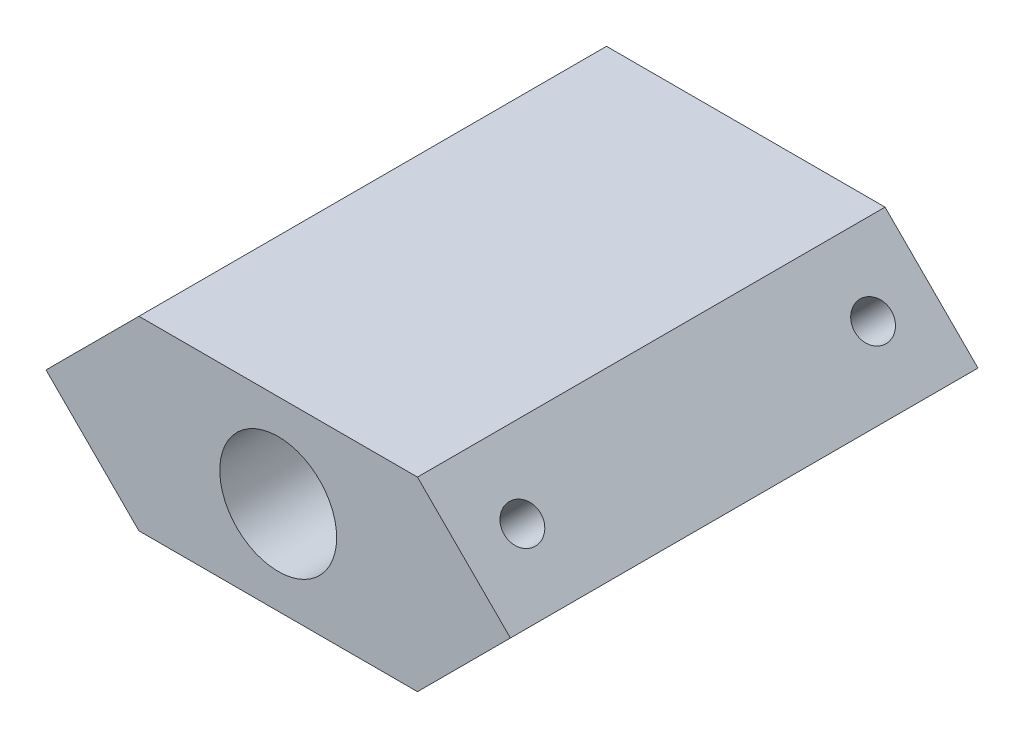
from build123d import *

# Parameters (mm, degrees)
ESQUISSE1_W             = 100.91
ESQUISSE1_H             = 40.386
BOSS_EXTRU_1_DEPTH      = 101.6
ENL_V_MAT_EXTRU_1_DEPTH = 101.6
ENL_V_MAT_EXTRU_2_DEPTH = 149.783121005
ESQUISSE5_R             = 3.975
ENL_V_MAT_EXTRU_3_DEPTH = 20
ESQUISSE6_R             = 3.937
ENL_V_MAT_EXTRU_4_DEPTH = 20
ESQUISSE7_R             = 3.937
ENL_V_MAT_EXTRU_5_DEPTH = 20
ESQUISSE8_R             = 3.937
ENL_V_MAT_EXTRU_6_DEPTH = 20
ESQUISSE9_R             = 6.35
ENL_V_MAT_EXTRU_7_DEPTH = 149.783121005
ESQUISSE10_R            = 9.525
ENL_V_MAT_EXTRU_8_DEPTH = 7.35
ESQUISSE11_R            = 12.7
ENL_V_MAT_EXTRU_9_DEPTH = 20.65


with BuildPart() as part:
    # Esquisse1 → Boss.-Extru.1 (new body)
    with BuildSketch(Plane.XY):
        with Locations((50.455, 20.193)):
            Rectangle(ESQUISSE1_W, ESQUISSE1_H)
    extrude(amount=BOSS_EXTRU_1_DEPTH)

    # Esquisse3 → Enlèv. mat.-Extru.1 (cut)
    with BuildSketch(Plane(origin=(0, 0, 0), x_dir=(-1, 0, 0), z_dir=(0, 0, -1))):
        Polygon((-100.91, 20.193), (-80.717, 0), (-100.91, 0), align=None)
        Polygon((0, 0), (0, 20.193), (-20.193, 0), align=None)
    extrude(amount=-ENL_V_MAT_EXTRU_1_DEPTH, mode=Mode.SUBTRACT)

    # Esquisse4 → Enlèv. mat.-Extru.2 (cut, through all)
    with BuildSketch(Plane(origin=(0, 0, 0), x_dir=(-1, 0, 0), z_dir=(0, 0, -1))):
        Polygon((-100.91, 20.193), (-80.717, 40.386), (-100.91, 40.386), align=None)
        Polygon((0, 40.386), (0, 20.193), (-20.193, 40.386), align=None)
    extrude(amount=-ENL_V_MAT_EXTRU_2_DEPTH, mode=Mode.SUBTRACT)

    # Esquisse5 → Enlèv. mat.-Extru.3 (cut)
    with BuildSketch(Plane(origin=(60.5515, 60.5515, 0), x_dir=(0, 0, -1), z_dir=(0.7071067811865488, 0.7071067811865464, 0))):
        with Locations(Location((-88.9, -42.796930825, 0), (0, 0, 90))):
            Circle(ESQUISSE5_R)
        with Locations(Location((-12.7, -42.796930825, 0), (0, 0, 90))):
            Circle(ESQUISSE5_R)
    extrude(amount=-ENL_V_MAT_EXTRU_3_DEPTH, mode=Mode.SUBTRACT)

    # Esquisse6 → Enlèv. mat.-Extru.4 (cut)
    with BuildSketch(Plane(origin=(10.0965, 10.0965, 0), x_dir=(0, 0, 1), z_dir=(-0.7071067811865475, -0.7071067811865476, 0))):
        with Locations(Location((12.7, 0, 0), (0, 0, 270))):
            Circle(ESQUISSE6_R)
        with Locations(Location((88.9, 0, 0), (0, 0, 270))):
            Circle(ESQUISSE6_R)
    extrude(amount=-ENL_V_MAT_EXTRU_4_DEPTH, mode=Mode.SUBTRACT)

    # Esquisse7 → Enlèv. mat.-Extru.5 (cut)
    with BuildSketch(Plane(origin=(-10.0965, 10.0965, 0), x_dir=(0, 0, 1), z_dir=(-0.7071067811865488, 0.7071067811865464, 0))):
        with Locations(Location((31.75, 28.557214465, 0), (0, 0, 270))):
            Circle(ESQUISSE7_R)
        with Locations(Location((69.85, 28.557214465, 0), (0, 0, 270))):
            Circle(ESQUISSE7_R)
    extrude(amount=-ENL_V_MAT_EXTRU_5_DEPTH, mode=Mode.SUBTRACT)

    # Esquisse8 → Enlèv. mat.-Extru.6 (cut)
    with BuildSketch(Plane(origin=(40.3585, -40.3585, 0), x_dir=(0, 0, -1), z_dir=(0.7071067811865475, -0.7071067811865476, 0))):
        with Locations(Location((-69.85, 71.35414529, 0), (0, 0, 90))):
            Circle(ESQUISSE8_R)
        with Locations(Location((-31.75, 71.35414529, 0), (0, 0, 90))):
            Circle(ESQUISSE8_R)
    extrude(amount=-ENL_V_MAT_EXTRU_6_DEPTH, mode=Mode.SUBTRACT)

    # Esquisse9 → Enlèv. mat.-Extru.7 (cut, through all)
    with BuildSketch(Plane(origin=(0, 0, 0), x_dir=(-1, 0, 0), z_dir=(0, 0, -1))):
        with Locations((-50.455, 20.193)):
            Circle(ESQUISSE9_R)
    extrude(amount=-ENL_V_MAT_EXTRU_7_DEPTH, mode=Mode.SUBTRACT)

    # Esquisse10 → Enlèv. mat.-Extru.8 (cut)
    with BuildSketch(Plane(origin=(0, 0, 0), x_dir=(-1, 0, 0), z_dir=(0, 0, -1))):
        with Locations((-50.455, 20.193)):
            Circle(ESQUISSE10_R)
    extrude(amount=-ENL_V_MAT_EXTRU_8_DEPTH, mode=Mode.SUBTRACT)

    # Esquisse11 → Enlèv. mat.-Extru.9 (cut)
    with BuildSketch(Plane.XY.offset(101.6)):
        with Locations((50.455, 20.193)):
            Circle(ESQUISSE11_R)
    extrude(amount=-ENL_V_MAT_EXTRU_9_DEPTH, mode=Mode.SUBTRACT)


solid = part.part
